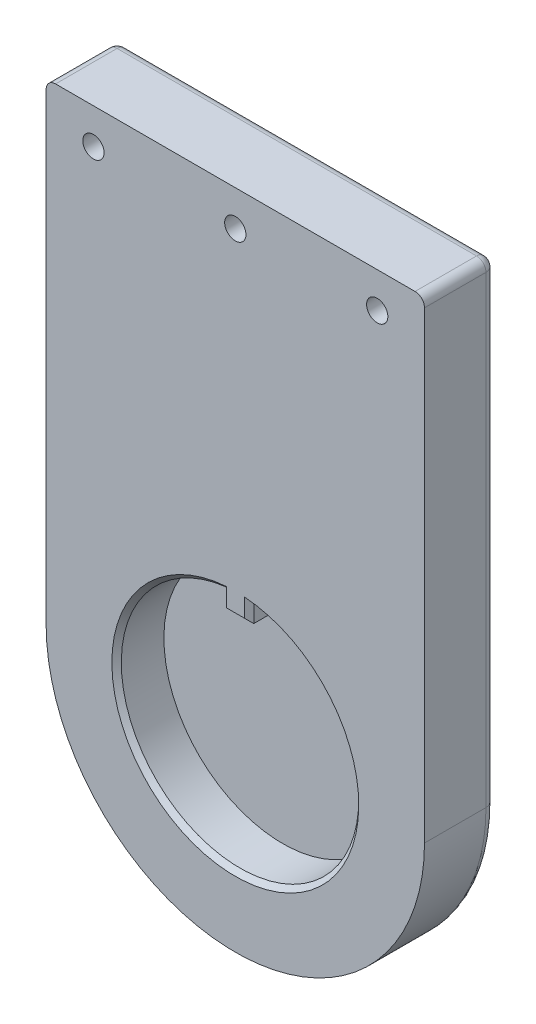
from build123d import *

# Parameters (mm, degrees)
SKETCH1_R           = 40
BOSS_EXTRUDE1_DEPTH = 15
SKETCH2_R           = 25.1
CUT_EXTRUDE1_DEPTH  = 10
BOSS_EXTRUDE2_DEPTH = 10
CHAMFER1_SIZE       = 1
BOSS_EXTRUDE3_DEPTH = 15
SKETCH5_R           = 2.25
CUT_EXTRUDE2_DEPTH  = 109.742815855
FILLET1_R           = 2


with BuildPart() as part:
    # Sketch1 → Boss-Extrude1 (new body)
    with BuildSketch(Plane.XY):
        Circle(SKETCH1_R)
    extrude(amount=BOSS_EXTRUDE1_DEPTH)

    # Sketch2 → Cut-Extrude1 (cut)
    with BuildSketch(Plane.XY.offset(15)):
        Circle(SKETCH2_R)
    extrude(amount=-CUT_EXTRUDE1_DEPTH, mode=Mode.SUBTRACT)

    # Sketch3 → Boss-Extrude2 (add)
    with BuildSketch(Plane.XY.offset(15)):
        with BuildLine():
            Line((2.9, 21.131907268), (-2.9, 21.131907268))
            Line((-2.9, 21.131907268), (-2.9, 24.931907268))
            ThreePointArc((-2.9, 24.931907268), (0, 25.1), (2.9, 24.931907268))
            Line((2.9, 24.931907268), (2.9, 21.131907268))
        make_face()
    extrude(amount=-BOSS_EXTRUDE2_DEPTH)

    # Chamfer1
    chamfer1_edges = [part.edges().sort_by_distance(p)[0] for p in [
        (0, -25.1, 15),
        (-2.9, 23.031907268, 15),
        (0, 21.131907268, 15),
        (2.9, 23.031907268, 15),
    ]]
    chamfer(chamfer1_edges, length=CHAMFER1_SIZE)

    # Sketch4 → Boss-Extrude3 (add, through all)
    with BuildSketch(Plane(origin=(0, 0, 0), x_dir=(-1, 0, 0), z_dir=(0, 0, -1))):
        with BuildLine():
            Line((-40, 0), (-40, 100))
            Line((-40, 100), (40, 100))
            Line((40, 100), (40, 0))
            ThreePointArc((40, 0), (0, 40), (-40, 0))
        make_face()
    extrude(amount=-BOSS_EXTRUDE3_DEPTH)

    # Sketch5 → Cut-Extrude2 (cut, through all)
    with BuildSketch(Plane(origin=(0, 0, 0), x_dir=(-1, 0, 0), z_dir=(0, 0, -1))):
        with Locations((0, 92.5)):
            Circle(SKETCH5_R)
        with Locations((-30, 92.5)):
            Circle(SKETCH5_R)
        with Locations(Location((30, 92.5, 0), (0, 0, 180))):
            Circle(SKETCH5_R)
    extrude(amount=-CUT_EXTRUDE2_DEPTH, mode=Mode.SUBTRACT)

    # Fillet1
    fillet1_edges = [part.edges().sort_by_distance(p)[0] for p in [
        (0, -40, 0),
        (40, 100, 7.5),
        (-40, 100, 7.5),
        (-40, 50, 0),
        (0, 100, 0),
        (40, 50, 0),
    ]]
    fillet(fillet1_edges, radius=FILLET1_R)


solid = part.part
